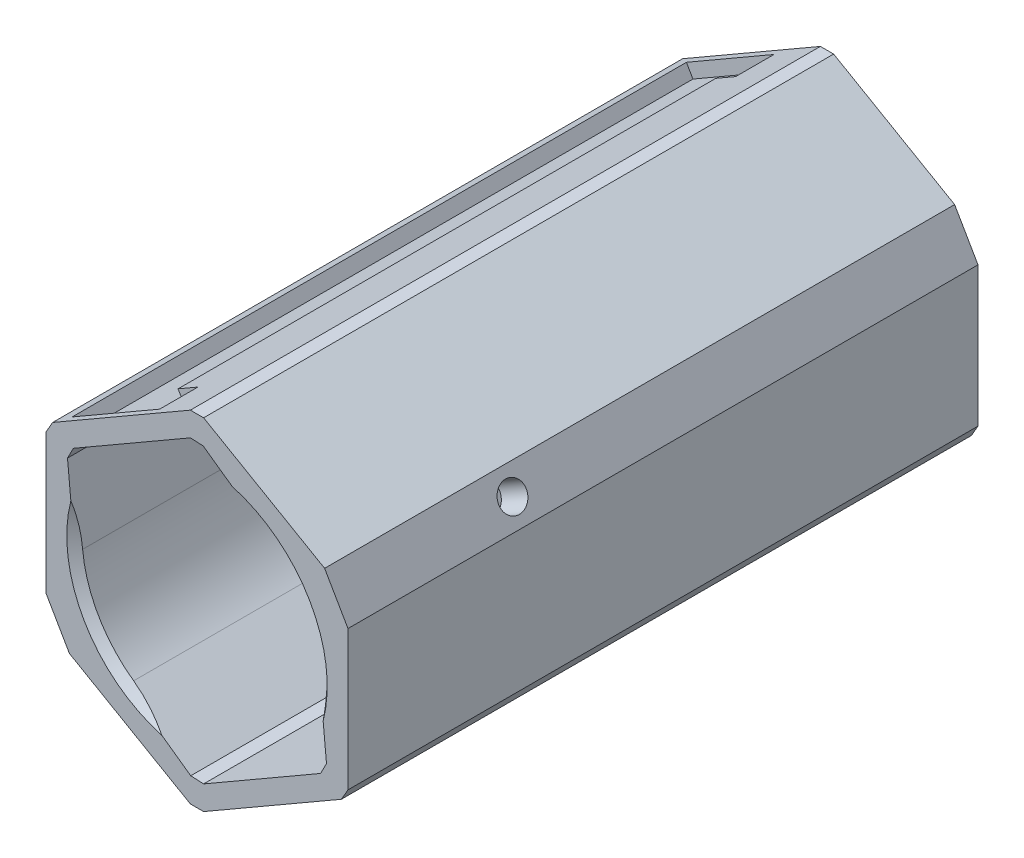
from build123d import *

# Parameters (mm, degrees)
SKETCH2_R               = 16
BOSS_EXTRUDE1_DEPTH     = 82.25
CUT_EXTRUDE1_DEPTH      = 97.457244414
CUT_EXTRUDE1_DEPTH_BACK = 97.457244414
SKETCH3_W               = 152.01959988
SKETCH3_H               = 124.433031562
CUT_EXTRUDE2_DEPTH      = 1.7
CHAMFER2_SIZE           = 1
CHAMFER3_SIZE           = 1
CUT_EXTRUDE3_DEPTH      = 71
CHAMFER4_SIZE           = 1
CUT_EXTRUDE4_DEPTH      = 1.2
SKETCH8_R               = 2.75
CUT_EXTRUDE5_DEPTH      = 87.332400234
CUT_EXTRUDE7_DEPTH      = 5
CHAMFER5_SIZE           = 0.5
CUT_EXTRUDE8_DEPTH      = 88.459952722
SKETCH12_R              = 1.8
CUT_EXTRUDE9_DEPTH      = 4
CUT_EXTRUDE10_START     = -4
SKETCH13_R              = 1.8
CUT_EXTRUDE10_DEPTH     = 4


with BuildPart() as part:
    # Sketch1 → Revolve1 (revolve)
    with BuildSketch(Plane(origin=(0, 0, 0), x_dir=(1, 0, 0), z_dir=(0, 1, 0))):
        Polygon((0, 0), (16.125, 0), (16.125, -71), (19.65, -71), (19.65, 68), (24.95, 68), (24.95, 73), (28.1, 73), (28.1, 68), (42, 68), (42, 76), (16.65, 76), (16.65, 18.004366875), (12.193967069, 18.004366875), (12.193967069, 24.882682167), (0, 24.882682167), align=None)
    revolve(axis=Axis((0, 0, 39.840023079), (0, 0, -1)))

    # Sketch2 → Boss-Extrude1 (add)
    with BuildSketch(Plane.XY.offset(71)):
        Polygon((0, 22.762034363), (-19.7125, 11.381017181), (-19.7125, -11.381017181), (0, -22.762034363), (19.7125, -11.381017181), (19.7125, 11.381017181), align=None)
        Circle(SKETCH2_R, mode=Mode.SUBTRACT)
    extrude(amount=-BOSS_EXTRUDE1_DEPTH)

    # Sketch3 → Cut-Extrude1 (cut, two sides: drawn at the far end of the back side and taken through both)
    with BuildSketch(Plane(origin=(0, 0, 0), x_dir=(1, 0, 0), z_dir=(0, 1, 0)).offset(-CUT_EXTRUDE1_DEPTH_BACK)):
        with Locations((6.162956752, 73.466515781)):
            Rectangle(SKETCH3_W, SKETCH3_H)
    extrude(amount=CUT_EXTRUDE1_DEPTH + CUT_EXTRUDE1_DEPTH_BACK, mode=Mode.SUBTRACT)

    # Sketch4 → Cut-Extrude2 (cut)
    with BuildSketch(Plane(origin=(-9.85625, 17.071525772, 0), x_dir=(0.8660254037844386, 0.5000000000000003, 0), z_dir=(-0.5000000000000002, 0.8660254037844385, 0))):
        Polygon((-8.6, 10.2), (4.6, 10.2), (4.6, 5.2), (1.6, 5.2), (1.6, -65), (4.6, -65), (4.6, -70), (-8.6, -70), align=None)
    extrude(amount=-CUT_EXTRUDE2_DEPTH, mode=Mode.SUBTRACT)

    # Chamfer2
    chamfer2_edges = [part.edges().sort_by_distance(p)[0] for p in [
        (0, 22.762034363, 29.875),
        (19.7125, 11.381017181, 29.875),
        (19.7125, -11.381017181, 29.875),
        (0, -22.762034363, 29.875),
        (-19.7125, -11.381017181, 29.875),
        (-19.7125, 11.381017181, 29.875),
    ]]
    chamfer(chamfer2_edges, length=CHAMFER2_SIZE)

    # Chamfer3
    chamfer3_edges = [part.edges().sort_by_distance(p)[0] for p in [
        (-16, 0, 71),
    ]]
    chamfer(chamfer3_edges, length=CHAMFER3_SIZE)

    # Sketch5 → Cut-Extrude3 (cut)
    with BuildSketch(Plane.XY.offset(71)):
        with BuildLine():
            Line((-17, 9.814954576), (-15.92887426, -1.50697207))
            ThreePointArc((-15.92887426, -1.50697207), (-8, 13.85640646), (9.269513225, 13.041323728))
            Line((9.269513225, 13.041323728), (0, 19.629909152))
            Line((0, 19.629909152), (-17, 9.814954576))
        make_face()
        with BuildLine():
            Line((0, -19.629909152), (17, -9.814954576))
            Line((17, -9.814954576), (15.92887426, 1.50697207))
            ThreePointArc((15.92887426, 1.50697207), (8, -13.856406461), (-9.269513225, -13.041323728))
            Line((-9.269513225, -13.041323728), (0, -19.629909152))
        make_face()
    extrude(amount=-CUT_EXTRUDE3_DEPTH, mode=Mode.SUBTRACT)

    # Chamfer4
    chamfer4_edges = [part.edges().sort_by_distance(p)[0] for p in [
        (0, -19.629909152, 35.5),
        (17, -9.814954576, 35.5),
        (0, 19.629909152, 35.5),
        (-17, 9.814954576, 35.5),
    ]]
    chamfer(chamfer4_edges, length=CHAMFER4_SIZE)

    # Sketch6 → Cut-Extrude4 (cut)
    with BuildSketch(Plane(origin=(0, 0, -11.25), x_dir=(-1, 0, 0), z_dir=(0, 0, -1))):
        Polygon((-7.289047149, 12.625), (-14.578094297, 0), (-7.289047149, -12.625), (7.289047149, -12.625), (14.578094297, 0), (7.289047149, 12.625), align=None)
    extrude(amount=-CUT_EXTRUDE4_DEPTH, mode=Mode.SUBTRACT)

    # Sketch8 → Cut-Extrude5 (cut, through all)
    with BuildSketch(Plane(origin=(0, 0, -10.05), x_dir=(-1, 0, 0), z_dir=(0, 0, -1))):
        Circle(SKETCH8_R)
    extrude(amount=-CUT_EXTRUDE5_DEPTH, mode=Mode.SUBTRACT)

    # Sketch10 → Cut-Extrude7 (cut)
    with BuildSketch(Plane.XY):
        with BuildLine():
            Line((2.5, 10), (-2.5, 10))
            Line((-2.5, 10), (-2.5, 7.071067812))
            ThreePointArc((-2.5, 7.071067812), (0, -7.5), (2.5, 7.071067812))
            Line((2.5, 7.071067812), (2.5, 10))
        make_face()
    extrude(amount=-CUT_EXTRUDE7_DEPTH, mode=Mode.SUBTRACT)

    # Chamfer5
    chamfer5_edges = [part.edges().sort_by_distance(p)[0] for p in [
        (0, -7.5, 0),
        (2.5, 8.535533906, 0),
        (0, 10, 0),
        (-2.5, 8.535533906, 0),
    ]]
    chamfer(chamfer5_edges, length=CHAMFER5_SIZE)

    # Sketch11 → Cut-Extrude8 (cut, through all)
    with BuildSketch(Plane.XY.offset(71)):
        Polygon((19.7125, 11.381017181), (16.660566959, 13.143051544), (19.7125, 7.856948456), align=None)
        Polygon((-16.660566959, -13.143051544), (-19.7125, -11.381017181), (-19.7125, -7.856948456), align=None)
    extrude(amount=-CUT_EXTRUDE8_DEPTH, mode=Mode.SUBTRACT)

    # Sketch12 → Cut-Extrude9 (cut)
    with BuildSketch(Plane(origin=(-18.186533479, -10.5, 0), x_dir=(0, 0, 1), z_dir=(-0.8660254037844382, -0.500000000000001, 0))):
        with Locations(Location((48, 0, 0), (0, 0, 270))):
            Circle(SKETCH12_R)
    extrude(amount=-CUT_EXTRUDE9_DEPTH, mode=Mode.SUBTRACT)

    # Sketch13 → Cut-Extrude10 (cut)
    with BuildSketch(Plane(origin=(18.186533479, 10.5, 0), x_dir=(0, 0, -1), z_dir=(0.8660254037844387, 0.4999999999999999, 0)).offset(CUT_EXTRUDE10_START)):
        with Locations(Location((-48, 0, 0), (0, 0, 270))):
            Circle(SKETCH13_R)
    extrude(amount=CUT_EXTRUDE10_DEPTH, mode=Mode.SUBTRACT)


solid = part.part
